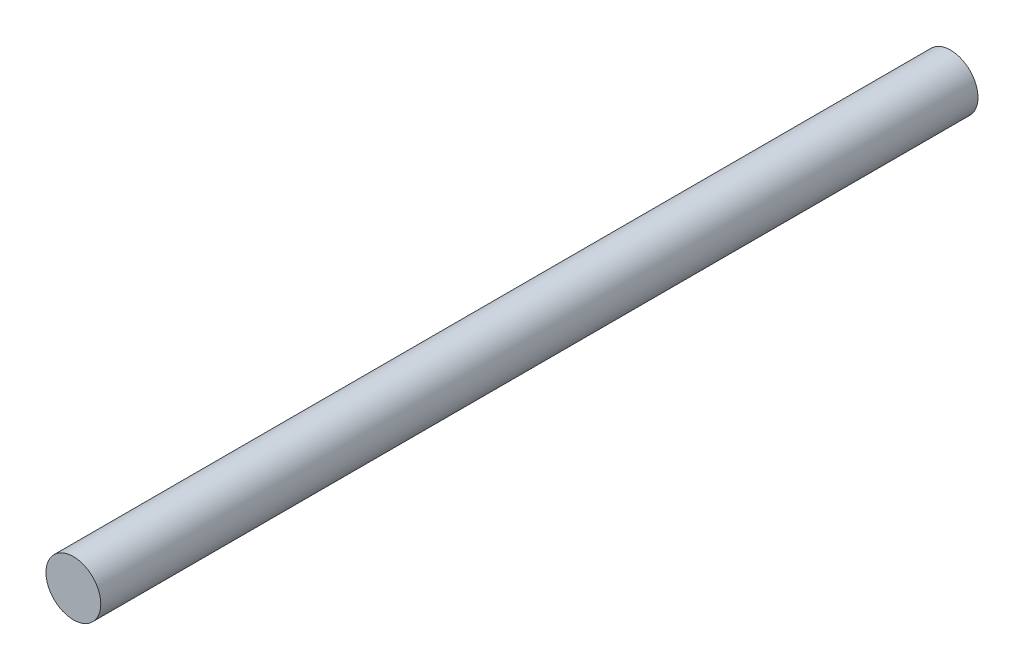
from build123d import *

# Parameters (mm, degrees)
BOSS_EXTRUDE1_DEPTH      = 76.2
BOSS_EXTRUDE1_DEPTH_BACK = 76.2
SKETCH3_R                = 4.7625


with BuildPart() as part:
    # Sketch3 → Boss-Extrude1 (new, two sides: drawn at the far end of the back side and taken through both)
    with BuildSketch(Plane.XY.offset(-BOSS_EXTRUDE1_DEPTH_BACK)):
        Circle(SKETCH3_R)
    extrude(amount=BOSS_EXTRUDE1_DEPTH + BOSS_EXTRUDE1_DEPTH_BACK)


solid = part.part
